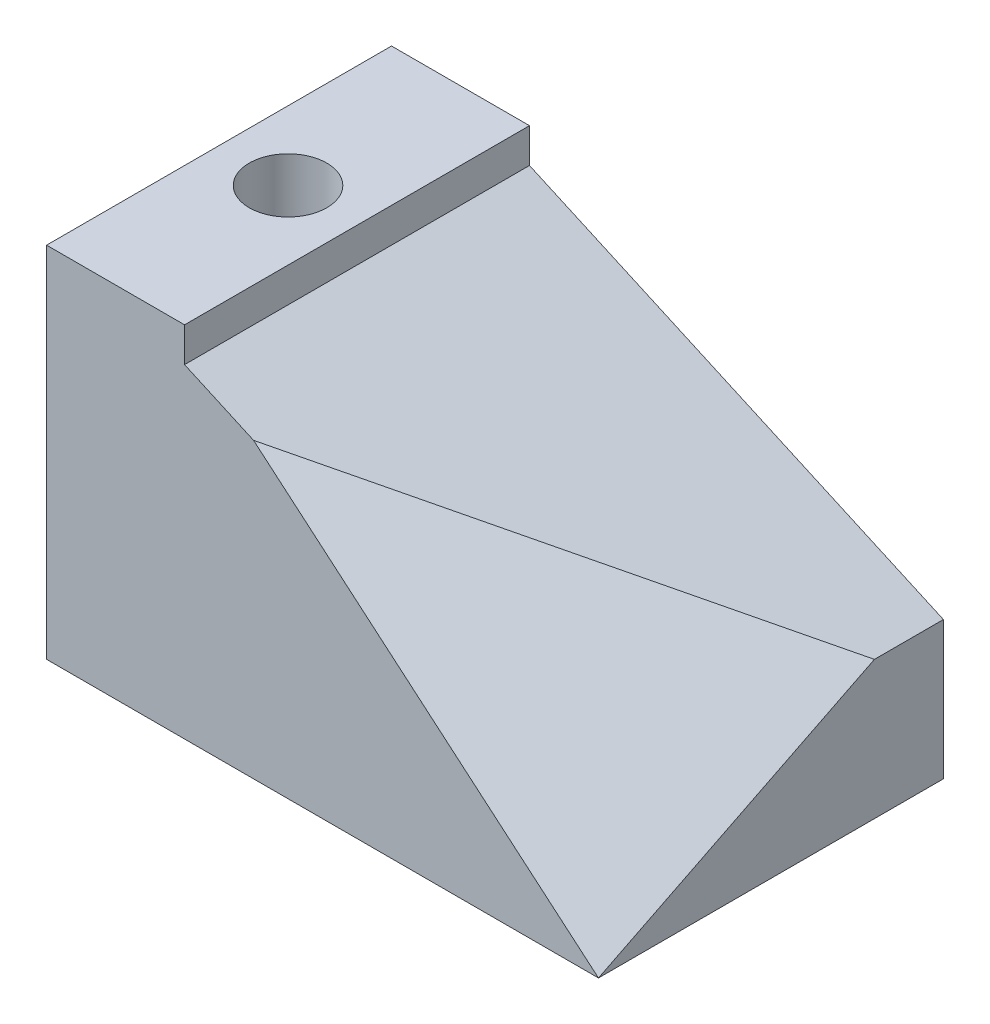
from build123d import *

# Parameters (mm, degrees)
SALIENTE_EXTRUIR1_DEPTH = 63.5
CROQUIS2_R              = 7.1374
CORTAR_EXTRUIR1_DEPTH   = 38.1
CORTAR_EXTRUIR2_DEPTH   = 38.1


with BuildPart() as part:
    # Croquis1 → Saliente-Extruir1 (new body)
    with BuildSketch(Plane.XY):
        Polygon((0, 0), (0, 66.04), (25.4, 66.04), (25.4, 59.69), (101.6, 25.4), (101.6, 0), align=None)
    extrude(amount=SALIENTE_EXTRUIR1_DEPTH)

    # Croquis2 → Cortar-Extruir1 (cut)
    with BuildSketch(Plane(origin=(0, 66.04, 0), x_dir=(1, 0, 0), z_dir=(0, 1, 0))):
        with Locations(Location((12.7, -31.75, 0), (0, 0, 270))):
            Circle(CROQUIS2_R)
    extrude(amount=-CORTAR_EXTRUIR1_DEPTH, mode=Mode.SUBTRACT)

    # Croquis3D1 → Cortar-Extruir2 (cut, along a direction that is not the sketch's normal)
    with BuildSketch(Plane(origin=(101.6, 0, 63.5), x_dir=(-0.7619393177594593, 0.6476484200955405, 0), z_dir=(-0.6052160263325688, -0.7120188545089043, -0.35600942725445217))):
        Polygon((0, 0), (16.45026987, 54.361646601), (83.339970152, 0), align=None)
    extrude(amount=-CORTAR_EXTRUIR2_DEPTH, dir=(-0.41036467732879794, -0.9119215051751064, 0), mode=Mode.SUBTRACT)


solid = part.part
